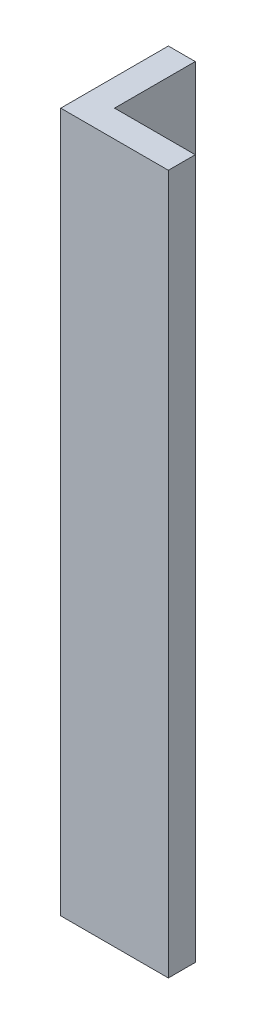
from build123d import *

# Parameters (mm, degrees)
BOSS_EXTRUDE1_DEPTH = 130


with BuildPart() as part:
    # Sketch1 → Boss-Extrude1 (new body)
    with BuildSketch(Plane(origin=(0, 0, 0), x_dir=(1, 0, 0), z_dir=(0, 1, 0))):
        Polygon((-11.903225806, 9.35483871), (-16.903225806, 9.35483871), (-16.903225806, -4.64516129), (-16.903225806, -10.64516129), (-8.580645161, -10.64516129), (3.096774194, -10.64516129), (3.096774194, -5.64516129), (-11.903225806, -5.64516129), align=None)
    extrude(amount=BOSS_EXTRUDE1_DEPTH)


solid = part.part
